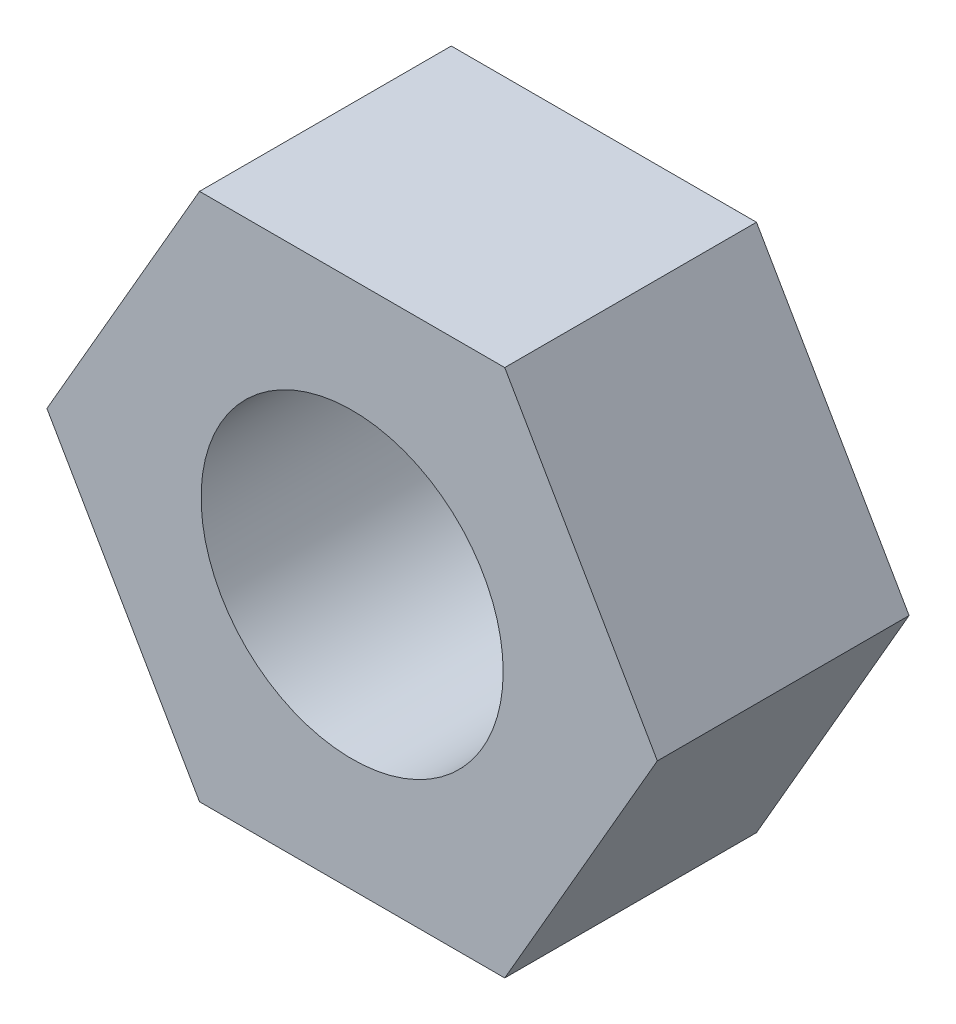
from build123d import *

# Parameters (mm, degrees)
SKETCH1_R           = 3
BOSS_EXTRUDE1_DEPTH = 5


with BuildPart() as part:
    # Sketch1 → Boss-Extrude1 (new body)
    with BuildSketch(Plane.XY):
        Polygon((6.062177826, 0), (3.031088913, 5.25), (-3.031088913, 5.25), (-6.062177826, 0), (-3.031088913, -5.25), (3.031088913, -5.25), align=None)
        Circle(SKETCH1_R, mode=Mode.SUBTRACT)
    extrude(amount=BOSS_EXTRUDE1_DEPTH)


solid = part.part
